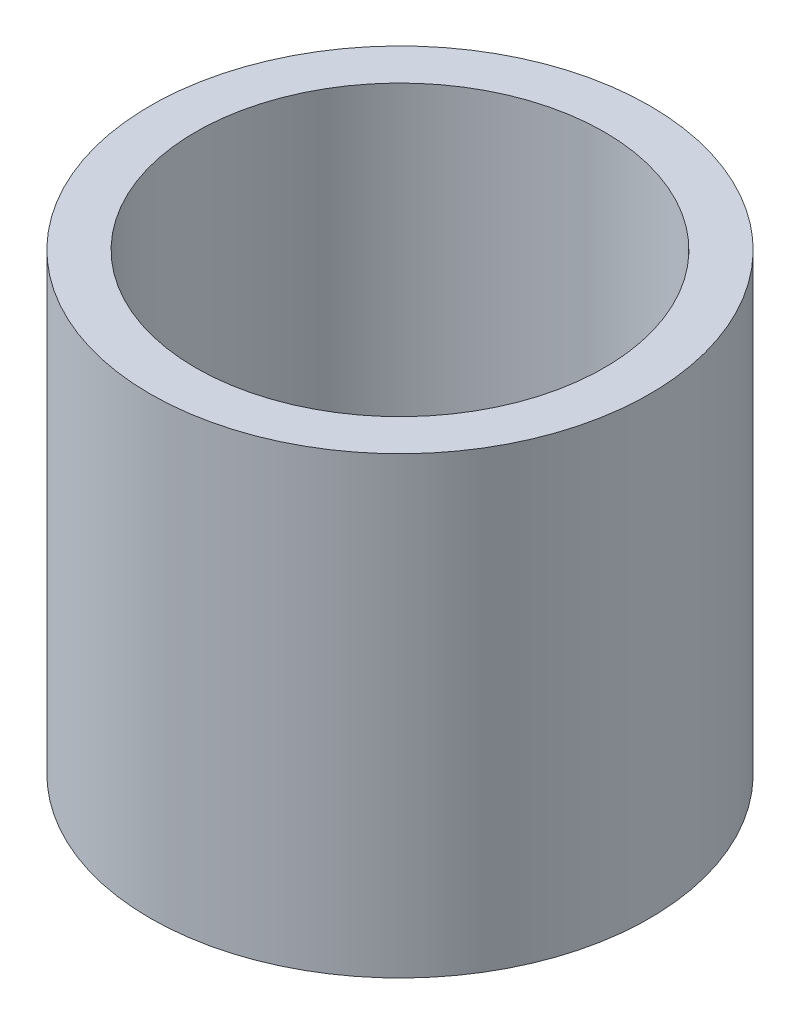
from build123d import *

# Parameters (mm, degrees)
ESQUISSE2_R        = 2.75
ESQUISSE2_R_2      = 2.25
BOSS_EXTRU_2_DEPTH = 5


with BuildPart() as part:
    # Esquisse2 → Boss.-Extru.2 (new body)
    with BuildSketch(Plane(origin=(0, 0, 0), x_dir=(1, 0, 0), z_dir=(0, 1, 0))):
        with Locations(Location((0, 0, 0), (0, 0, 270))):
            Circle(ESQUISSE2_R)
        with Locations(Location((0, 0, 0), (0, 0, 270))):
            Circle(ESQUISSE2_R_2, mode=Mode.SUBTRACT)
    extrude(amount=BOSS_EXTRU_2_DEPTH)


solid = part.part
